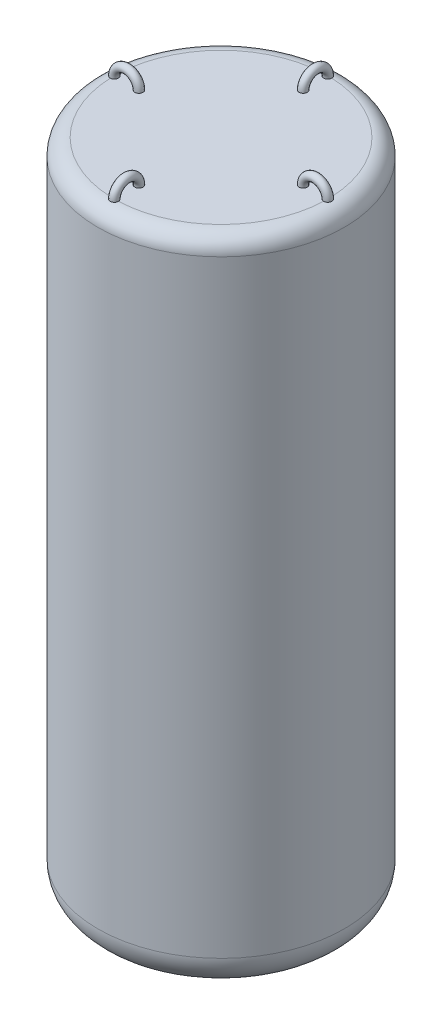
from build123d import *

# Parameters (mm, degrees)
SKETCH1_R           = 190.5
BOSS_EXTRUDE1_DEPTH = 1016
FILLET1_R           = 50.8
FILLET2_R           = 25.4
SKETCH2_R           = 6.35
SKETCH5_R           = 6.35
SKETCH7_R           = 6.35
SKETCH6_R           = 6.35


with BuildPart() as part:
    # Sketch1 → Boss-Extrude1 (new body)
    with BuildSketch(Plane(origin=(0, 0, 0), x_dir=(1, 0, 0), z_dir=(0, 1, 0))):
        with Locations(Location((0, 0, 0), (0, 0, 270))):
            Circle(SKETCH1_R)
    extrude(amount=-BOSS_EXTRUDE1_DEPTH)

    # Fillet1
    fillet1_edges = [part.edges().sort_by_distance(p)[0] for p in [
        (0, -1016, -190.5),
    ]]
    fillet(fillet1_edges, radius=FILLET1_R)

    # Fillet2
    fillet2_edges = [part.edges().sort_by_distance(p)[0] for p in [
        (0, 0, -190.5),
    ]]
    fillet(fillet2_edges, radius=FILLET2_R)

    # Sweep1: sweep along a path in Sketch3
    with BuildLine(Plane.XY) as sweep1_path:
        ThreePointArc((-127, 0), (-146.05, 19.05), (-165.1, 0))
    # Sketch2 → Sweep1 (sweep)
    with BuildSketch(Plane(origin=(0, 0, 0), x_dir=(1, 0, 0), z_dir=(0, 1, 0))):
        with Locations((-165.1, 0)):
            Circle(SKETCH2_R)
    sweep(path=sweep1_path.line)

    # Sweep2: sweep along a path in Sketch4
    with BuildLine(Plane.XY) as sweep2_path:
        ThreePointArc((165.1, 0), (146.05, 19.05), (127, 0))
    # Sketch5 → Sweep2 (sweep)
    with BuildSketch(Plane(origin=(0, 0, 0), x_dir=(1, 0, 0), z_dir=(0, 1, 0))):
        with Locations((165.1, 0)):
            Circle(SKETCH5_R)
    sweep(path=sweep2_path.line)

    # Sweep3: sweep along a path in Sketch8
    with BuildLine(Plane(origin=(0, 0, 0), x_dir=(0, 0, -1), z_dir=(1, 0, 0))) as sweep3_path:
        ThreePointArc((-127, 0), (-146.05, 19.05), (-165.1, 0))
    # Sketch7 → Sweep3 (sweep)
    with BuildSketch(Plane(origin=(0, 0, 0), x_dir=(1, 0, 0), z_dir=(0, 1, 0))):
        with Locations((0, -165.1)):
            Circle(SKETCH7_R)
    sweep(path=sweep3_path.line)

    # Sweep4: sweep along a path in Sketch9
    with BuildLine(Plane(origin=(0, 0, 0), x_dir=(0, 0, -1), z_dir=(1, 0, 0))) as sweep4_path:
        ThreePointArc((165.1, 0), (146.05, 19.05), (127, 0))
    # Sketch6 → Sweep4 (sweep)
    with BuildSketch(Plane(origin=(0, 0, 0), x_dir=(1, 0, 0), z_dir=(0, 1, 0))):
        with Locations((0, 165.1)):
            Circle(SKETCH6_R)
    sweep(path=sweep4_path.line)


solid = part.part
